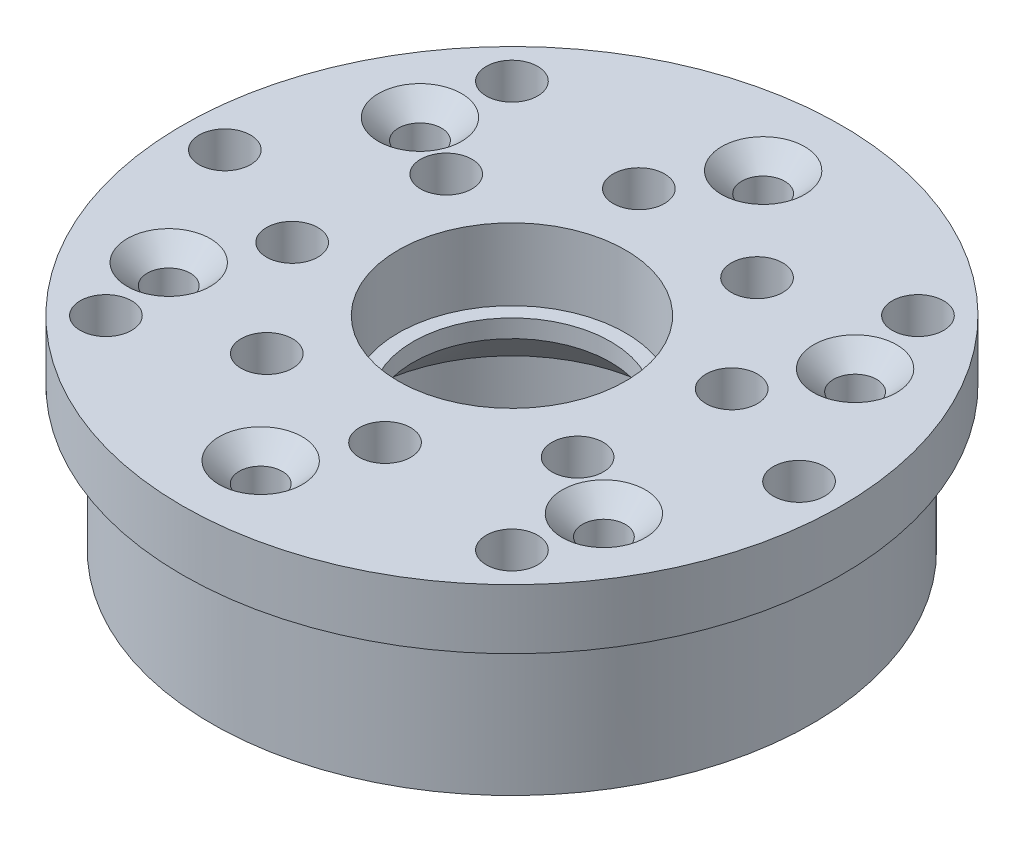
from build123d import *

# Parameters (mm, degrees)
SKETCH1_R                                            = 25.1
SKETCH1_R_2                                          = 2.5
SKETCH1_R_3                                          = 8.25
BOSS_EXTRUDE1_DEPTH                                  = 10
SKETCH2_R                                            = 15.5
SKETCH2_R_2                                          = 9.5
BOSS_EXTRUDE2_DEPTH                                  = 8.5
SKETCH4_R                                            = 9.5
SKETCH4_R_2                                          = 8.25
BOSS_EXTRUDE3_DEPTH                                  = 2.5
SKETCH3_R                                            = 12.5
CUT_EXTRUDE1_DEPTH                                   = 11
CHAMFER1_SIZE                                        = 3
SKETCH5_R                                            = 25.1
SKETCH5_R_2                                          = 2.5
SKETCH5_R_3                                          = 15.5
BOSS_EXTRUDE4_DEPTH                                  = 8.5
BOSS_EXTRUDE5_START                                  = -5
SKETCH6_R                                            = 27.55
SKETCH6_R_2                                          = 25.1
BOSS_EXTRUDE5_DEPTH                                  = 5
SKETCH11_R                                           = 2.15
CUT_EXTRUDE3_DEPTH                                   = 4.8
SKETCH12_R                                           = 25.1
SKETCH12_R_2                                         = 2.5
SKETCH12_R_3                                         = 12.5
CUT_EXTRUDE4_DEPTH                                   = 1.5
BOSS_EXTRUDE8_START                                  = -4.5
SKETCH14_R                                           = 2.5
SKETCH14_R_2                                         = 1.5
BOSS_EXTRUDE8_DEPTH                                  = 4.5
CSK_FOR_M3_SOCKET_COUNTERSUNK_HEAD_SCREW_D           = 3.6
CSK_FOR_M3_SOCKET_COUNTERSUNK_HEAD_SCREW_CSINK_D     = 6.94
CSK_FOR_M3_SOCKET_COUNTERSUNK_HEAD_SCREW_CSINK_ANGLE = 90


with BuildPart() as part:
    # Sketch1 → Boss-Extrude1 (new body)
    with BuildSketch(Plane(origin=(0, 0, 0), x_dir=(1, 0, 0), z_dir=(0, 1, 0))):
        with Locations(Location((0, 0, 0), (0, 0, 270))):
            Circle(SKETCH1_R)
        with Locations(Location((0, 21, 0), (0, 0, 270))):
            Circle(SKETCH1_R_2, mode=Mode.SUBTRACT)
        with Locations(Location((18.186533479, 10.5, 0), (0, 0, 270))):
            Circle(SKETCH1_R_2, mode=Mode.SUBTRACT)
        with Locations(Location((18.186533479, -10.5, 0), (0, 0, 270))):
            Circle(SKETCH1_R_2, mode=Mode.SUBTRACT)
        with Locations(Location((0, -21, 0), (0, 0, 270))):
            Circle(SKETCH1_R_2, mode=Mode.SUBTRACT)
        with Locations(Location((-18.186533479, -10.5, 0), (0, 0, 270))):
            Circle(SKETCH1_R_2, mode=Mode.SUBTRACT)
        with Locations(Location((-18.186533479, 10.5, 0), (0, 0, 270))):
            Circle(SKETCH1_R_2, mode=Mode.SUBTRACT)
        with Locations(Location((0, 0, 0), (0, 0, 270))):
            Circle(SKETCH1_R_3, mode=Mode.SUBTRACT)
    extrude(amount=BOSS_EXTRUDE1_DEPTH)

    # Sketch2 → Boss-Extrude2 (add)
    with BuildSketch(Plane(origin=(0, 10, 0), x_dir=(1, 0, 0), z_dir=(0, 1, 0))):
        with Locations(Location((0, 0, 0), (0, 0, 270))):
            Circle(SKETCH2_R)
        with Locations(Location((0, 0, 0), (0, 0, 270))):
            Circle(SKETCH2_R_2, mode=Mode.SUBTRACT)
    extrude(amount=BOSS_EXTRUDE2_DEPTH)

    # Sketch4 → Boss-Extrude3 (add)
    with BuildSketch(Plane(origin=(0, 10, 0), x_dir=(1, 0, 0), z_dir=(0, 1, 0))):
        with Locations(Location((0, 0, 0), (0, 0, 270))):
            Circle(SKETCH4_R)
        with Locations(Location((0, 0, 0), (0, 0, 270))):
            Circle(SKETCH4_R_2, mode=Mode.SUBTRACT)
    extrude(amount=BOSS_EXTRUDE3_DEPTH)

    # Sketch3 → Cut-Extrude1 (cut)
    with BuildSketch(Plane.XZ):
        with Locations(Location((0, 0, 0), (0, 0, 270))):
            Circle(SKETCH3_R)
    extrude(amount=-CUT_EXTRUDE1_DEPTH, mode=Mode.SUBTRACT)

    # Chamfer1
    chamfer1_edges = [part.edges().sort_by_distance(p)[0] for p in [
        (0, 11, 12.5),
    ]]
    chamfer(chamfer1_edges, length=CHAMFER1_SIZE)

    # Sketch5 → Boss-Extrude4 (add)
    with BuildSketch(Plane(origin=(0, 10, 0), x_dir=(1, 0, 0), z_dir=(0, 1, 0))):
        with Locations(Location((0, 0, 0), (0, 0, 270))):
            Circle(SKETCH5_R)
        with Locations(Location((0, 21, 0), (0, 0, 270))):
            Circle(SKETCH5_R_2, mode=Mode.SUBTRACT)
        with Locations(Location((18.187152059, 10.499642863, 0), (0, 0, 60.008184899))):
            Circle(SKETCH5_R_2, mode=Mode.SUBTRACT)
        with Locations(Location((18.187152059, -10.50107141, 0), (0, 0, 30.014176717))):
            Circle(SKETCH5_R_2, mode=Mode.SUBTRACT)
        with Locations(Location((0, -21.001428547, 0), (0, 0, 179.983629985))):
            Circle(SKETCH5_R_2, mode=Mode.SUBTRACT)
        with Locations(Location((-18.187152059, -10.50107141, 0), (0, 0, 149.985823141))):
            Circle(SKETCH5_R_2, mode=Mode.SUBTRACT)
        with Locations(Location((-18.187152059, 10.499642863, 0), (0, 0, 119.991814957))):
            Circle(SKETCH5_R_2, mode=Mode.SUBTRACT)
        Circle(SKETCH5_R_3, mode=Mode.SUBTRACT)
    extrude(amount=BOSS_EXTRUDE4_DEPTH)

    # Sketch6 → Boss-Extrude5 (add)
    with BuildSketch(Plane(origin=(0, 18.5, 0), x_dir=(1, 0, 0), z_dir=(0, 1, 0)).offset(BOSS_EXTRUDE5_START)):
        with Locations(Location((0, 0, 0), (0, 0, 270))):
            Circle(SKETCH6_R)
        with Locations(Location((0, 0, 0), (0, 0, 270))):
            Circle(SKETCH6_R_2, mode=Mode.SUBTRACT)
    extrude(amount=BOSS_EXTRUDE5_DEPTH)

    # Sketch11 → Cut-Extrude3 (cut)
    with BuildSketch(Plane(origin=(0, 18.5, 0), x_dir=(1, 0, 0), z_dir=(0, 1, 0))):
        with Locations(Location((7.5, 12.990381057, 0), (0, 0, 270))):
            Circle(SKETCH11_R)
        with Locations(Location((14.488887394, 3.882285677, 0), (0, 0, 270))):
            Circle(SKETCH11_R)
        with Locations(Location((12.990381057, -7.5, 0), (0, 0, 270))):
            Circle(SKETCH11_R)
        with Locations(Location((3.882285677, -14.488887394, 0), (0, 0, 270))):
            Circle(SKETCH11_R)
        with Locations(Location((-7.5, -12.990381057, 0), (0, 0, 270))):
            Circle(SKETCH11_R)
        with Locations(Location((-14.488887394, -3.882285677, 0), (0, 0, 270))):
            Circle(SKETCH11_R)
        with Locations(Location((-24, 0, 0), (0, 0, 270))):
            Circle(SKETCH11_R)
        with Locations(Location((-16.970562748, 16.970562748, 0), (0, 0, 270))):
            Circle(SKETCH11_R)
        with Locations(Location((16.970562748, 16.970562748, 0), (0, 0, 270))):
            Circle(SKETCH11_R)
        with Locations(Location((24, 0, 0), (0, 0, 270))):
            Circle(SKETCH11_R)
        with Locations(Location((16.970562748, -16.970562748, 0), (0, 0, 270))):
            Circle(SKETCH11_R)
        with Locations(Location((-12.990381057, 7.5, 0), (0, 0, 270))):
            Circle(SKETCH11_R)
        with Locations(Location((-3.882285677, 14.488887394, 0), (0, 0, 270))):
            Circle(SKETCH11_R)
        with Locations(Location((-16.970562748, -16.970562748, 0), (0, 0, 270))):
            Circle(SKETCH11_R)
    extrude(amount=-CUT_EXTRUDE3_DEPTH, mode=Mode.SUBTRACT)

    # Sketch12 → Cut-Extrude4 (cut)
    with BuildSketch(Plane.XZ):
        with Locations(Location((0, 0, 0), (0, 0, 270))):
            Circle(SKETCH12_R)
        with Locations(Location((18.186533479, 10.5, 0), (0, 0, 270))):
            Circle(SKETCH12_R_2, mode=Mode.SUBTRACT)
        with Locations(Location((18.186533479, -10.5, 0), (0, 0, 270))):
            Circle(SKETCH12_R_2, mode=Mode.SUBTRACT)
        with Locations(Location((0, -21, 0), (0, 0, 270))):
            Circle(SKETCH12_R_2, mode=Mode.SUBTRACT)
        with Locations(Location((-18.186533479, -10.5, 0), (0, 0, 270))):
            Circle(SKETCH12_R_2, mode=Mode.SUBTRACT)
        with Locations(Location((-18.186533479, 10.5, 0), (0, 0, 270))):
            Circle(SKETCH12_R_2, mode=Mode.SUBTRACT)
        with Locations(Location((0, 21, 0), (0, 0, 270))):
            Circle(SKETCH12_R_2, mode=Mode.SUBTRACT)
        with Locations(Location((0, 0, 0), (0, 0, 270))):
            Circle(SKETCH12_R_3, mode=Mode.SUBTRACT)
    extrude(amount=-CUT_EXTRUDE4_DEPTH, mode=Mode.SUBTRACT)

    # Sketch14 → Boss-Extrude8 (add)
    # profile 1 of 6: a face of its own
    with BuildSketch(Plane(origin=(0, 18.5, 0), x_dir=(1, 0, 0), z_dir=(0, 1, 0)).offset(BOSS_EXTRUDE8_START)):
        with Locations(Location((0, 21, 0), (0, 0, 90))):
            Circle(SKETCH14_R)
        with Locations(Location((0, 21, 0), (0, 0, 270))):
            Circle(SKETCH14_R_2, mode=Mode.SUBTRACT)
    # profile 2 of 6: a face of its own
    with BuildSketch(Plane(origin=(0, 18.5, 0), x_dir=(1, 0, 0), z_dir=(0, 1, 0)).offset(BOSS_EXTRUDE8_START)):
        with Locations(Location((18.187152059, 10.499642863, 0), (0, 0, 60.008184899))):
            Circle(SKETCH14_R)
        with Locations(Location((18.187152059, 10.499642863, 0), (0, 0, 270))):
            Circle(SKETCH14_R_2, mode=Mode.SUBTRACT)
    # profile 3 of 6: a face of its own
    with BuildSketch(Plane(origin=(0, 18.5, 0), x_dir=(1, 0, 0), z_dir=(0, 1, 0)).offset(BOSS_EXTRUDE8_START)):
        with Locations(Location((18.187152059, -10.50107141, 0), (0, 0, 30.014176717))):
            Circle(SKETCH14_R)
        with Locations(Location((18.187152059, -10.50107141, 0), (0, 0, 270))):
            Circle(SKETCH14_R_2, mode=Mode.SUBTRACT)
    # profile 4 of 6: a face of its own
    with BuildSketch(Plane(origin=(0, 18.5, 0), x_dir=(1, 0, 0), z_dir=(0, 1, 0)).offset(BOSS_EXTRUDE8_START)):
        with Locations(Location((0, -21.001428547, 0), (0, 0, 179.983629985))):
            Circle(SKETCH14_R)
        with Locations(Location((0, -21.001428547, 0), (0, 0, 270))):
            Circle(SKETCH14_R_2, mode=Mode.SUBTRACT)
    # profile 5 of 6: a face of its own
    with BuildSketch(Plane(origin=(0, 18.5, 0), x_dir=(1, 0, 0), z_dir=(0, 1, 0)).offset(BOSS_EXTRUDE8_START)):
        with Locations(Location((-18.187152059, -10.50107141, 0), (0, 0, 149.985823141))):
            Circle(SKETCH14_R)
        with Locations(Location((-18.187152059, -10.50107141, 0), (0, 0, 270))):
            Circle(SKETCH14_R_2, mode=Mode.SUBTRACT)
    # profile 6 of 6: a face of its own
    with BuildSketch(Plane(origin=(0, 18.5, 0), x_dir=(1, 0, 0), z_dir=(0, 1, 0)).offset(BOSS_EXTRUDE8_START)):
        with Locations(Location((-18.187152059, 10.499642863, 0), (0, 0, 119.991814957))):
            Circle(SKETCH14_R)
        with Locations(Location((-18.187152059, 10.499642863, 0), (0, 0, 270))):
            Circle(SKETCH14_R_2, mode=Mode.SUBTRACT)
    extrude(amount=BOSS_EXTRUDE8_DEPTH)

    # CSK for M3 socket countersunk head screw1 (through all)
    with Locations(Plane(origin=(0, 18.5, 0), x_dir=(1, 0, 0), z_dir=(0, 1, 0))):
        with Locations((0, 21), (18.187152059, 10.499642863), (18.187152059, -10.50107141), (0, -21.001428547), (-18.187152059, -10.50107141), (-18.187152059, 10.499642863)):
            CounterSinkHole(CSK_FOR_M3_SOCKET_COUNTERSUNK_HEAD_SCREW_D / 2, CSK_FOR_M3_SOCKET_COUNTERSUNK_HEAD_SCREW_CSINK_D / 2, counter_sink_angle=CSK_FOR_M3_SOCKET_COUNTERSUNK_HEAD_SCREW_CSINK_ANGLE)

    # Sketch17 → Revolve1 (revolve)
    with BuildSketch(Plane.XY, mode=Mode.PRIVATE) as revolve1_sk:
        Polygon((-8.25, 11), (-12.5, 6.75), (-12.5, 8), (-9.5, 11), align=None)
    revolve(revolve1_sk.sketch.rotate(Axis((0, 0, 0), (0, 1, 0)), 270), axis=Axis((0, 0, 0), (0, 1, 0)))


solid = part.part
